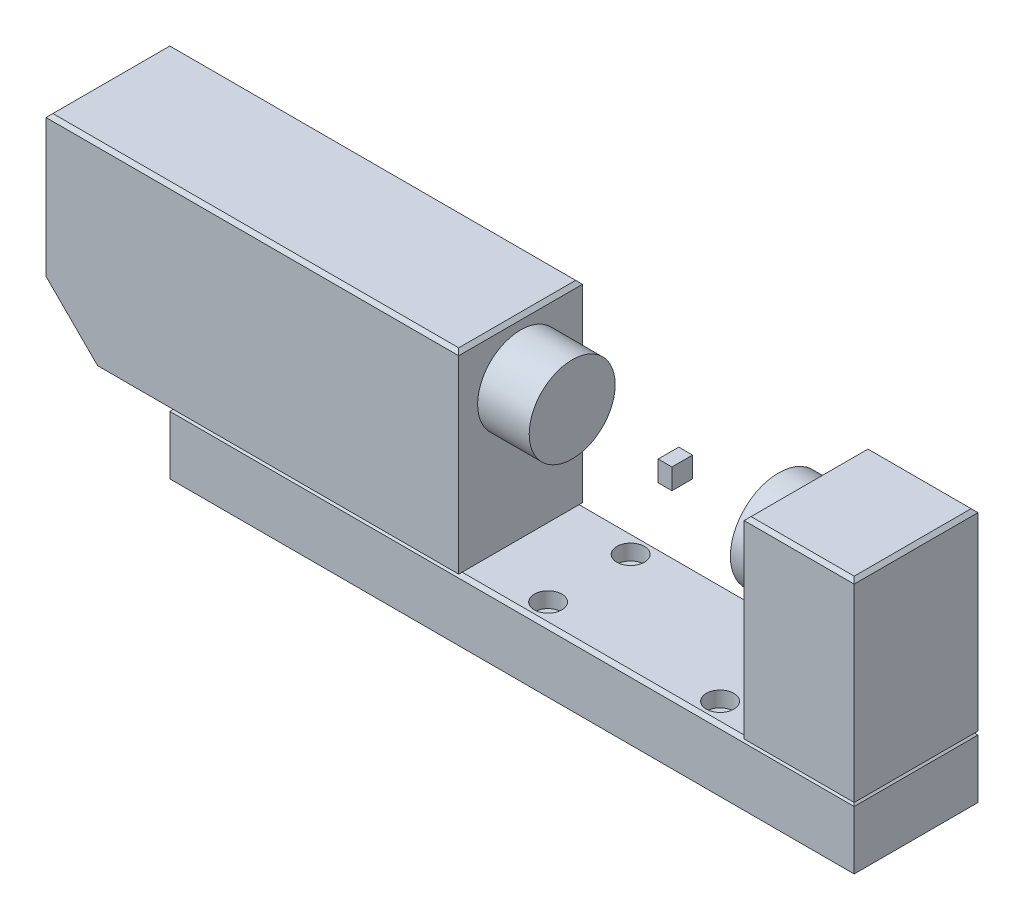
from build123d import *

# Parameters (mm, degrees)
SKETCH1_W           = 199
SKETCH1_H           = 36
BOSS_EXTRUDE1_DEPTH = 18
SKETCH2_R           = 4
CUT_EXTRUDE1_DEPTH  = 4.5
CUT_EXTRUDE2_REACH  = 132.948
SKETCH3_R           = 2.25
CHAMFER1_SIZE       = 1
SKETCH4_W           = 120
SKETCH4_H           = 36
SKETCH4_W_2         = 32
BOSS_EXTRUDE2_DEPTH = 56
CHAMFER2_SIZE       = 1
CHAMFER3_SIZE       = 15
SKETCH5_R           = 12.5
BOSS_EXTRUDE3_DEPTH = 15
SKETCH6_R           = 14
BOSS_EXTRUDE4_DEPTH = 8
SKETCH7_W           = 6
SKETCH7_H           = 6
BOSS_EXTRUDE5_DEPTH = 2


with BuildPart() as part:
    # Sketch1 → Boss-Extrude1 (new body)
    with BuildSketch(Plane(origin=(0, 0, 0), x_dir=(1, 0, 0), z_dir=(0, 1, 0))):
        with Locations((-29.5, 0)):
            Rectangle(SKETCH1_W, SKETCH1_H)
    extrude(amount=BOSS_EXTRUDE1_DEPTH)

    # Sketch2 → Cut-Extrude1 (cut)
    with BuildSketch(Plane(origin=(0, 18, 0), x_dir=(1, 0, 0), z_dir=(0, 1, 0))):
        with Locations(Location((-25, 12, 0), (0, 0, 270))):
            Circle(SKETCH2_R)
        with Locations(Location((25, 12, 0), (0, 0, 90))):
            Circle(SKETCH2_R)
        with Locations(Location((25, -12, 0), (0, 0, 270))):
            Circle(SKETCH2_R)
        with Locations(Location((-25, -12, 0), (0, 0, 90))):
            Circle(SKETCH2_R)
    extrude(amount=-CUT_EXTRUDE1_DEPTH, mode=Mode.SUBTRACT)

    # Sketch3 → Cut-Extrude2 (cut, up to next)
    with BuildSketch(Plane(origin=(0, 13.5, 0), x_dir=(1, 0, 0), z_dir=(0, 1, 0)), mode=Mode.PRIVATE) as cut_extrude2_sk1:
        with Locations(Location((-25, 12, 0), (0, 0, 270))):
            Circle(SKETCH3_R)
    cut_extrude2_tool1 = extrude(cut_extrude2_sk1.sketch, amount=-CUT_EXTRUDE2_REACH, mode=Mode.PRIVATE) & part.part
    # Sketch3 → Cut-Extrude2 (cut, up to next)
    with BuildSketch(Plane(origin=(0, 13.5, 0), x_dir=(1, 0, 0), z_dir=(0, 1, 0)), mode=Mode.PRIVATE) as cut_extrude2_sk2:
        with Locations(Location((-25, -12, 0), (0, 0, 270))):
            Circle(SKETCH3_R)
    cut_extrude2_tool2 = extrude(cut_extrude2_sk2.sketch, amount=-CUT_EXTRUDE2_REACH, mode=Mode.PRIVATE) & part.part
    # Sketch3 → Cut-Extrude2 (cut, up to next)
    with BuildSketch(Plane(origin=(0, 13.5, 0), x_dir=(1, 0, 0), z_dir=(0, 1, 0)), mode=Mode.PRIVATE) as cut_extrude2_sk3:
        with Locations(Location((25, 12, 0), (0, 0, 270))):
            Circle(SKETCH3_R)
    cut_extrude2_tool3 = extrude(cut_extrude2_sk3.sketch, amount=-CUT_EXTRUDE2_REACH, mode=Mode.PRIVATE) & part.part
    # Sketch3 → Cut-Extrude2 (cut, up to next)
    with BuildSketch(Plane(origin=(0, 13.5, 0), x_dir=(1, 0, 0), z_dir=(0, 1, 0)), mode=Mode.PRIVATE) as cut_extrude2_sk4:
        with Locations(Location((25, -12, 0), (0, 0, 270))):
            Circle(SKETCH3_R)
    cut_extrude2_tool4 = extrude(cut_extrude2_sk4.sketch, amount=-CUT_EXTRUDE2_REACH, mode=Mode.PRIVATE) & part.part
    add(cut_extrude2_tool1.solids().sort_by_distance((-25, 13.5, -12))[0], mode=Mode.SUBTRACT)
    add(cut_extrude2_tool2.solids().sort_by_distance((-25, 13.5, 12))[0], mode=Mode.SUBTRACT)
    add(cut_extrude2_tool3.solids().sort_by_distance((25, 13.5, -12))[0], mode=Mode.SUBTRACT)
    add(cut_extrude2_tool4.solids().sort_by_distance((25, 13.5, 12))[0], mode=Mode.SUBTRACT)

    # Chamfer1
    chamfer1_edges = [part.edges().sort_by_distance(p)[0] for p in [
        (70, 18, 0),
        (-29.5, 18, -18),
        (-129, 18, 0),
        (-29.5, 18, 18),
    ]]
    chamfer(chamfer1_edges, length=CHAMFER1_SIZE)

    # Sketch4 → Boss-Extrude2 (add)
    with BuildSketch(Plane(origin=(0, 18, 0), x_dir=(1, 0, 0), z_dir=(0, 1, 0))):
        with Locations((-105, 0)):
            Rectangle(SKETCH4_W, SKETCH4_H)
        with Locations((54, 0)):
            Rectangle(SKETCH4_W_2, SKETCH4_H)
    extrude(amount=BOSS_EXTRUDE2_DEPTH)

    # Chamfer2
    chamfer2_edges = [part.edges().sort_by_distance(p)[0] for p in [
        (-45, 74, 0),
        (-105, 74, -18),
        (-165, 74, 0),
        (-105, 74, 18),
        (38, 74, 0),
        (54, 74, 18),
        (70, 74, 0),
        (54, 74, -18),
    ]]
    chamfer(chamfer2_edges, length=CHAMFER2_SIZE)

    # Chamfer3
    chamfer3_edges = [part.edges().sort_by_distance(p)[0] for p in [
        (-165, 18, 0),
    ]]
    chamfer(chamfer3_edges, length=CHAMFER3_SIZE)

    # Sketch5 → Boss-Extrude3 (add)
    with BuildSketch(Plane(origin=(-45, 0, 0), x_dir=(0, 0, -1), z_dir=(1, 0, 0))):
        with Locations(Location((0, 58, 0), (0, 0, 180))):
            Circle(SKETCH5_R)
    extrude(amount=BOSS_EXTRUDE3_DEPTH)

    # Sketch6 → Boss-Extrude4 (add)
    with BuildSketch(Plane.ZY.offset(-38)):
        with Locations(Location((0, 58, 0), (0, 0, 180))):
            Circle(SKETCH6_R)
    extrude(amount=BOSS_EXTRUDE4_DEPTH)


with BuildPart() as body_2:
    # Sketch7 → Boss-Extrude5 (new, symmetric)
    with BuildSketch(Plane(origin=(0, 0, 0), x_dir=(0, 0, -1), z_dir=(1, 0, 0))):
        with Locations((0, 58)):
            Rectangle(SKETCH7_W, SKETCH7_H)
    extrude(amount=BOSS_EXTRUDE5_DEPTH, both=True)


solid = Compound([part.part, body_2.part])
